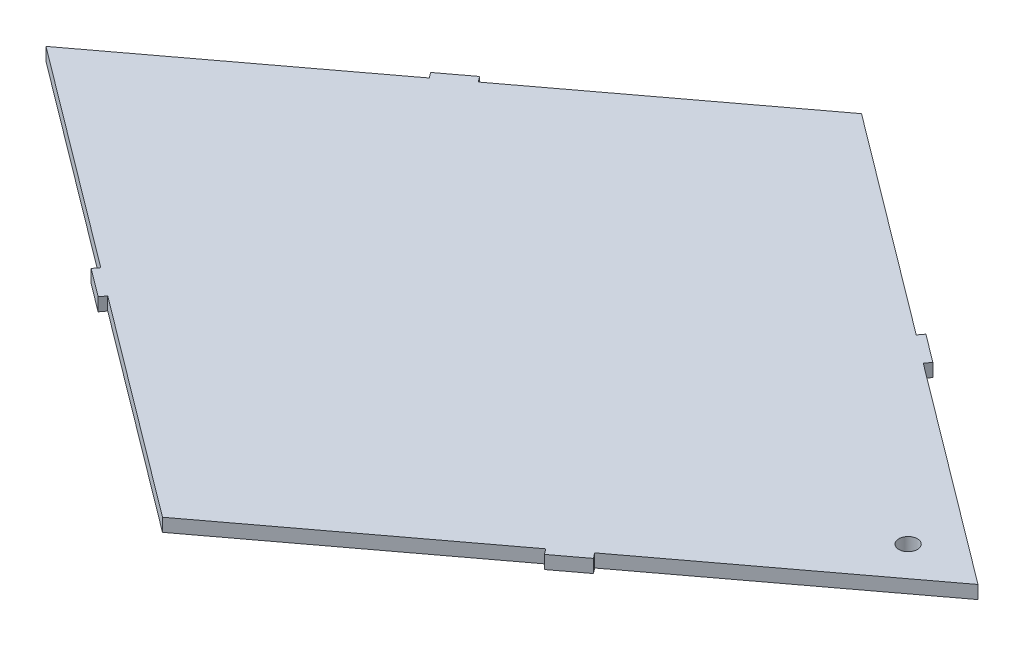
from build123d import *

# Parameters (mm, degrees)
SKETCH1_R           = 4
BOSS_EXTRUDE1_DEPTH = 5.63


with BuildPart() as part:
    # Sketch1 → Boss-Extrude1 (new body)
    with BuildSketch(Plane(origin=(0, 0, 0), x_dir=(1, 0, 0), z_dir=(0, 1, 0))):
        Polygon((0, 150), (94, 79.5), (95.77, 81.86), (107.77, 72.86), (106, 70.5), (200, 0), (106, -70.5), (107.77, -72.86), (95.77, -81.86), (94, -79.5), (0, -150), (-94, -79.5), (-95.77, -81.86), (-107.77, -72.86), (-106, -70.5), (-200, 0), (-106, 70.5), (-107.77, 72.86), (-95.77, 81.86), (-94, 79.5), align=None)
        with Locations(Location((170, 0, 0), (0, 0, 270))):
            Circle(SKETCH1_R, mode=Mode.SUBTRACT)
    extrude(amount=BOSS_EXTRUDE1_DEPTH)


solid = part.part
